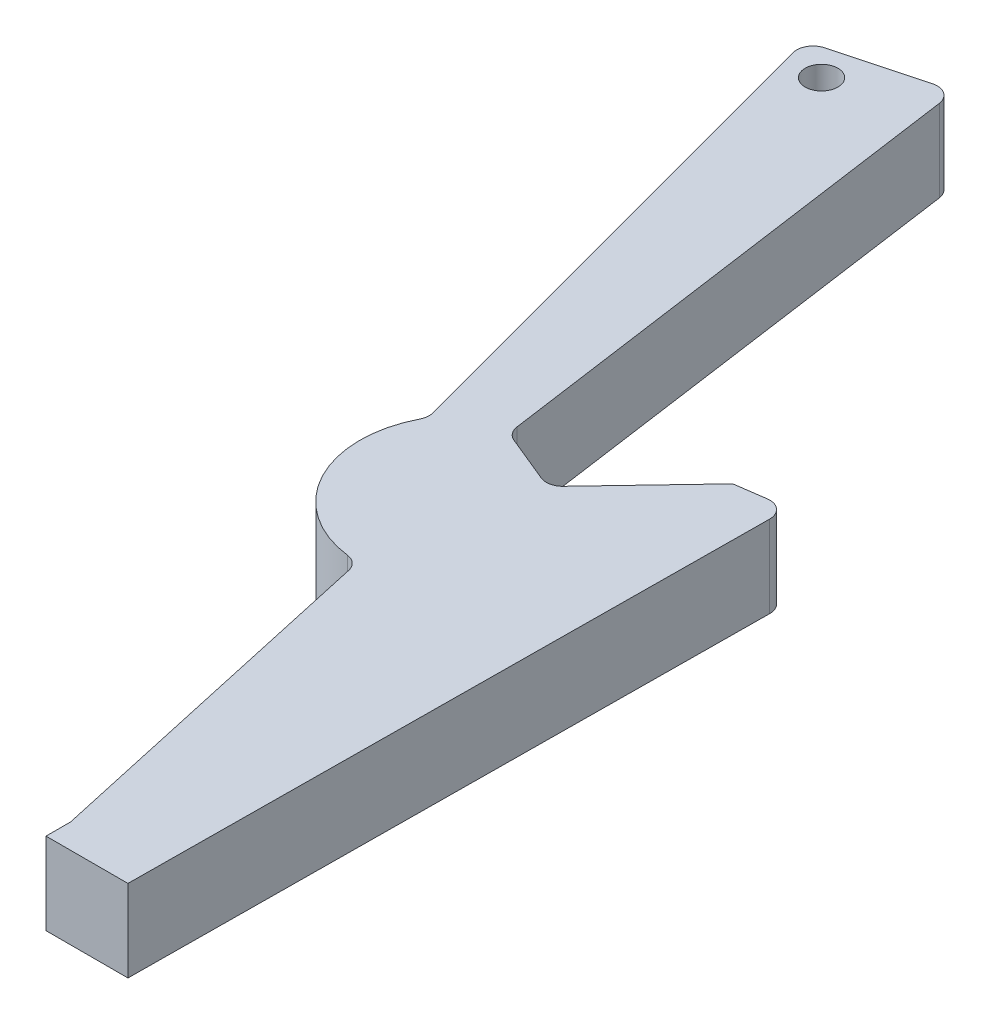
from build123d import *

# Parameters (mm, degrees)
BOSS_EXTRUDE1_DEPTH = 10
SKETCH2_R           = 2
CUT_EXTRUDE1_DEPTH  = 97.487793931
FILLET1_R           = 2


with BuildPart() as part:
    # Sketch1 → Boss-Extrude1 (new body)
    with BuildSketch(Plane(origin=(0, 0, 0), x_dir=(1, 0, 0), z_dir=(0, 1, 0))):
        with BuildLine():
            Line((23.899700969, 76.587880496), (9.410813575, 72.70559482))
            Line((9.410813575, 72.70559482), (26.234051507, 9.920416111))
            ThreePointArc((26.234051507, 9.920416111), (26.122890324, -3.007620786), (37.221477465, -9.638447153))
            Line((37.221477465, -9.638447153), (47.155900716, -54.638447153))
            Line((47.155900716, -54.638447153), (47.155900716, -57.638447153))
            Line((47.155900716, -57.638447153), (57.155900716, -57.638447153))
            Line((57.155900716, -57.638447153), (57.828980094, 22.361552847))
            Line((57.828980094, 22.361552847), (51.828980094, 21.518307839))
            Line((51.828980094, 21.518307839), (40.806779431, 9.920416111))
            Line((40.806779431, 9.920416111), (32.806779431, 13.210724097))
            Line((32.806779431, 13.210724097), (23.899700969, 76.587880496))
        make_face()
    extrude(amount=BOSS_EXTRUDE1_DEPTH)

    # Sketch2 → Cut-Extrude1 (cut, through all)
    with BuildSketch(Plane(origin=(0, 10, 0), x_dir=(1, 0, 0), z_dir=(0, 1, 0))):
        with Locations(Location((14.309793061, 69.877167695, 0), (0, 0, 270))):
            Circle(SKETCH2_R)
    extrude(amount=-CUT_EXTRUDE1_DEPTH, mode=Mode.SUBTRACT)

    # Fillet1
    fillet1_edges = [part.edges().sort_by_distance(p)[0] for p in [
        (37.221477465, 5, 9.638447153),
        (26.234051507, 5, -9.920416111),
        (9.410813575, 5, -72.70559482),
        (23.899700969, 5, -76.587880496),
        (32.806779431, 5, -13.210724097),
        (40.806779431, 5, -9.920416111),
        (57.828980094, 5, -22.361552847),
    ]]
    fillet(fillet1_edges, radius=FILLET1_R)


solid = part.part
